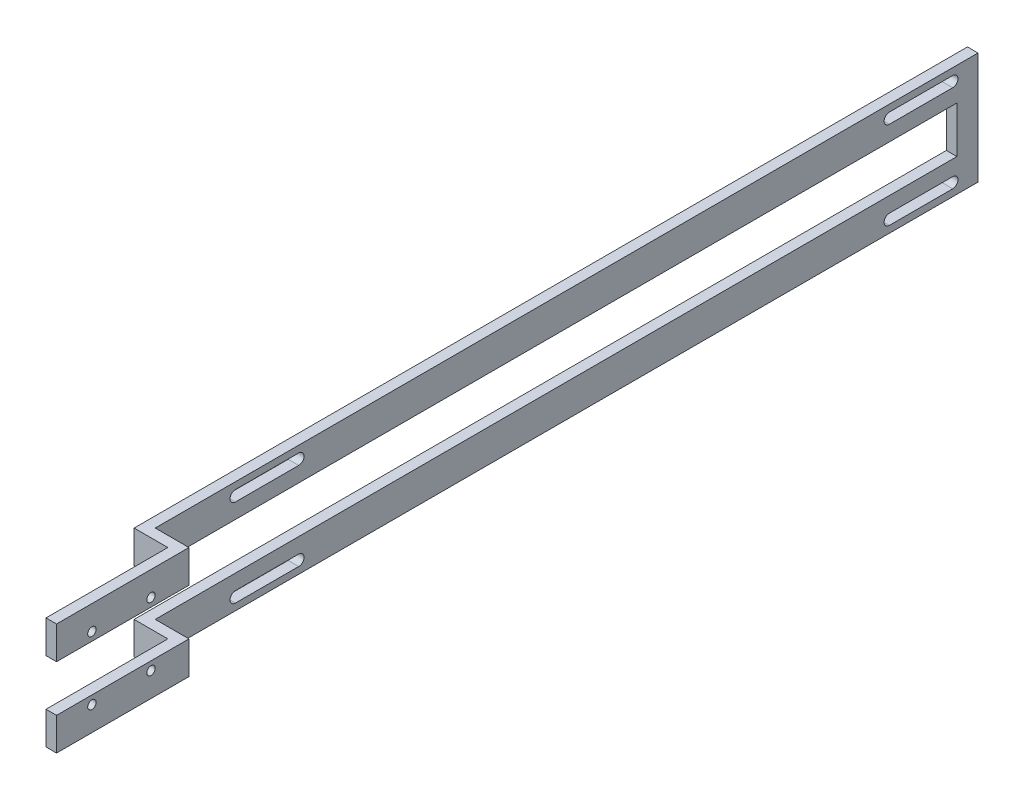
from build123d import *

# Parameters (mm, degrees)
EXTRUDE_1_DEPTH     = 53
CUT_EXTRUDE_2_REACH = 472.389
SKETCH_2_W          = 75
SKETCH_2_H          = 22
CUT_EXTRUDE_5_REACH = 471.913
SKETCH_4_R          = 2
CUT_EXTRUDE_6_REACH = 471.052
SKETCH_3_W          = 380
SKETCH_3_H          = 22
CUT_EXTRUDE_7_REACH = 470.746
SKETCH_6_W          = 93.868990514
SKETCH_6_H          = 40.944884918
CUT_EXTRUDE_8_DEPTH = 470.912954074


with BuildPart() as part:
    # 草图1 → 凸台-拉伸1 (new body)
    with BuildSketch(Plane(origin=(0, 0, 0), x_dir=(1, 0, 0), z_dir=(0, 1, 0))):
        Polygon((0, 0), (0, 70), (-16, 70), (-16, 465), (-11, 465), (-11, 75), (5, 75), (5, 0), (5, -16.047693785), (-42.239607079, -16.047693785), (-42.239607079, 0), align=None)
    extrude(amount=EXTRUDE_1_DEPTH)

    # 草图2 → 切除-拉伸2 (cut, up to next)
    with BuildSketch(Plane(origin=(5, 0, 0), x_dir=(0, 0, -1), z_dir=(1, 0, 0)), mode=Mode.PRIVATE) as cut_extrude_2_sk1:
        with Locations((37.5, 26.5)):
            Rectangle(SKETCH_2_W, SKETCH_2_H)
    cut_extrude_2_tool1 = extrude(cut_extrude_2_sk1.sketch, amount=-CUT_EXTRUDE_2_REACH, mode=Mode.PRIVATE) & part.part
    add(cut_extrude_2_tool1.solids().sort_by_distance((5, 26.5, -37.5))[0], mode=Mode.SUBTRACT)

    # 草图4 → 切除-拉伸5 (cut, up to next)
    with BuildSketch(Plane.ZY, mode=Mode.PRIVATE) as cut_extrude_5_sk1:
        with Locations((-57, 11.5)):
            Circle(SKETCH_4_R)
    cut_extrude_5_tool1 = extrude(cut_extrude_5_sk1.sketch, amount=-CUT_EXTRUDE_5_REACH, mode=Mode.PRIVATE) & part.part
    # 草图4 → 切除-拉伸5 (cut, up to next)
    with BuildSketch(Plane.ZY, mode=Mode.PRIVATE) as cut_extrude_5_sk2:
        with Locations((-57, 41.5)):
            Circle(SKETCH_4_R)
    cut_extrude_5_tool2 = extrude(cut_extrude_5_sk2.sketch, amount=-CUT_EXTRUDE_5_REACH, mode=Mode.PRIVATE) & part.part
    # 草图4 → 切除-拉伸5 (cut, up to next)
    with BuildSketch(Plane.ZY, mode=Mode.PRIVATE) as cut_extrude_5_sk3:
        with Locations((-29, 11.5)):
            Circle(SKETCH_4_R)
    cut_extrude_5_tool3 = extrude(cut_extrude_5_sk3.sketch, amount=-CUT_EXTRUDE_5_REACH, mode=Mode.PRIVATE) & part.part
    # 草图4 → 切除-拉伸5 (cut, up to next)
    with BuildSketch(Plane.ZY, mode=Mode.PRIVATE) as cut_extrude_5_sk4:
        with Locations((-29, 41.5)):
            Circle(SKETCH_4_R)
    cut_extrude_5_tool4 = extrude(cut_extrude_5_sk4.sketch, amount=-CUT_EXTRUDE_5_REACH, mode=Mode.PRIVATE) & part.part
    add(cut_extrude_5_tool1.solids().sort_by_distance((0, 11.5, -57))[0], mode=Mode.SUBTRACT)
    add(cut_extrude_5_tool2.solids().sort_by_distance((0, 41.5, -57))[0], mode=Mode.SUBTRACT)
    add(cut_extrude_5_tool3.solids().sort_by_distance((0, 11.5, -29))[0], mode=Mode.SUBTRACT)
    add(cut_extrude_5_tool4.solids().sort_by_distance((0, 41.5, -29))[0], mode=Mode.SUBTRACT)

    # 草图3 → 切除-拉伸6 (cut, up to next)
    with BuildSketch(Plane(origin=(-11, 0, 0), x_dir=(0, 0, -1), z_dir=(1, 0, 0)), mode=Mode.PRIVATE) as cut_extrude_6_sk1:
        with Locations((265, 26.5)):
            Rectangle(SKETCH_3_W, SKETCH_3_H)
    cut_extrude_6_tool1 = extrude(cut_extrude_6_sk1.sketch, amount=-CUT_EXTRUDE_6_REACH, mode=Mode.PRIVATE) & part.part
    add(cut_extrude_6_tool1.solids().sort_by_distance((-11, 26.5, -265))[0], mode=Mode.SUBTRACT)

    # 草图5 → 切除-拉伸7 (cut, up to next)
    with BuildSketch(Plane.ZY.offset(16), mode=Mode.PRIVATE) as cut_extrude_7_sk1:
        with BuildLine():
            Line((-143, 8.3), (-113, 8.3))
            ThreePointArc((-113, 8.3), (-110.45, 5.75), (-113, 3.2))
            Line((-113, 3.2), (-143, 3.2))
            ThreePointArc((-143, 3.2), (-145.55, 5.75), (-143, 8.3))
        make_face()
    cut_extrude_7_tool1 = extrude(cut_extrude_7_sk1.sketch, amount=-CUT_EXTRUDE_7_REACH, mode=Mode.PRIVATE) & part.part
    # 草图5 → 切除-拉伸7 (cut, up to next)
    with BuildSketch(Plane.ZY.offset(16), mode=Mode.PRIVATE) as cut_extrude_7_sk2:
        with BuildLine():
            Line((-143, 49.8), (-113, 49.8))
            ThreePointArc((-113, 49.8), (-110.45, 47.25), (-113, 44.7))
            Line((-113, 44.7), (-143, 44.7))
            ThreePointArc((-143, 44.7), (-145.55, 47.25), (-143, 49.8))
        make_face()
    cut_extrude_7_tool2 = extrude(cut_extrude_7_sk2.sketch, amount=-CUT_EXTRUDE_7_REACH, mode=Mode.PRIVATE) & part.part
    # 草图5 → 切除-拉伸7 (cut, up to next)
    with BuildSketch(Plane.ZY.offset(16), mode=Mode.PRIVATE) as cut_extrude_7_sk3:
        with BuildLine():
            Line((-423, 3.25), (-453, 3.25))
            ThreePointArc((-453, 3.25), (-455.5, 5.75), (-453, 8.25))
            Line((-453, 8.25), (-423, 8.25))
            ThreePointArc((-423, 8.25), (-420.5, 5.75), (-423, 3.25))
        make_face()
    cut_extrude_7_tool3 = extrude(cut_extrude_7_sk3.sketch, amount=-CUT_EXTRUDE_7_REACH, mode=Mode.PRIVATE) & part.part
    # 草图5 → 切除-拉伸7 (cut, up to next)
    with BuildSketch(Plane.ZY.offset(16), mode=Mode.PRIVATE) as cut_extrude_7_sk4:
        with BuildLine():
            Line((-423, 44.75), (-453, 44.75))
            ThreePointArc((-453, 44.75), (-455.5, 47.25), (-453, 49.75))
            Line((-453, 49.75), (-423, 49.75))
            ThreePointArc((-423, 49.75), (-420.5, 47.25), (-423, 44.75))
        make_face()
    cut_extrude_7_tool4 = extrude(cut_extrude_7_sk4.sketch, amount=-CUT_EXTRUDE_7_REACH, mode=Mode.PRIVATE) & part.part
    add(cut_extrude_7_tool1.solids().sort_by_distance((-16, 5.75, -128))[0], mode=Mode.SUBTRACT)
    add(cut_extrude_7_tool2.solids().sort_by_distance((-16, 47.25, -128))[0], mode=Mode.SUBTRACT)
    add(cut_extrude_7_tool3.solids().sort_by_distance((-16, 5.75, -438))[0], mode=Mode.SUBTRACT)
    add(cut_extrude_7_tool4.solids().sort_by_distance((-16, 47.25, -438))[0], mode=Mode.SUBTRACT)

    # 草图6 → 切除-拉伸8 (cut, through all)
    with BuildSketch(Plane(origin=(0, 53, 0), x_dir=(1, 0, 0), z_dir=(0, 1, 0))):
        with Locations((-15.853082152, -8.235463886)):
            Rectangle(SKETCH_6_W, SKETCH_6_H)
    extrude(amount=-CUT_EXTRUDE_8_DEPTH, mode=Mode.SUBTRACT)


solid = part.part
